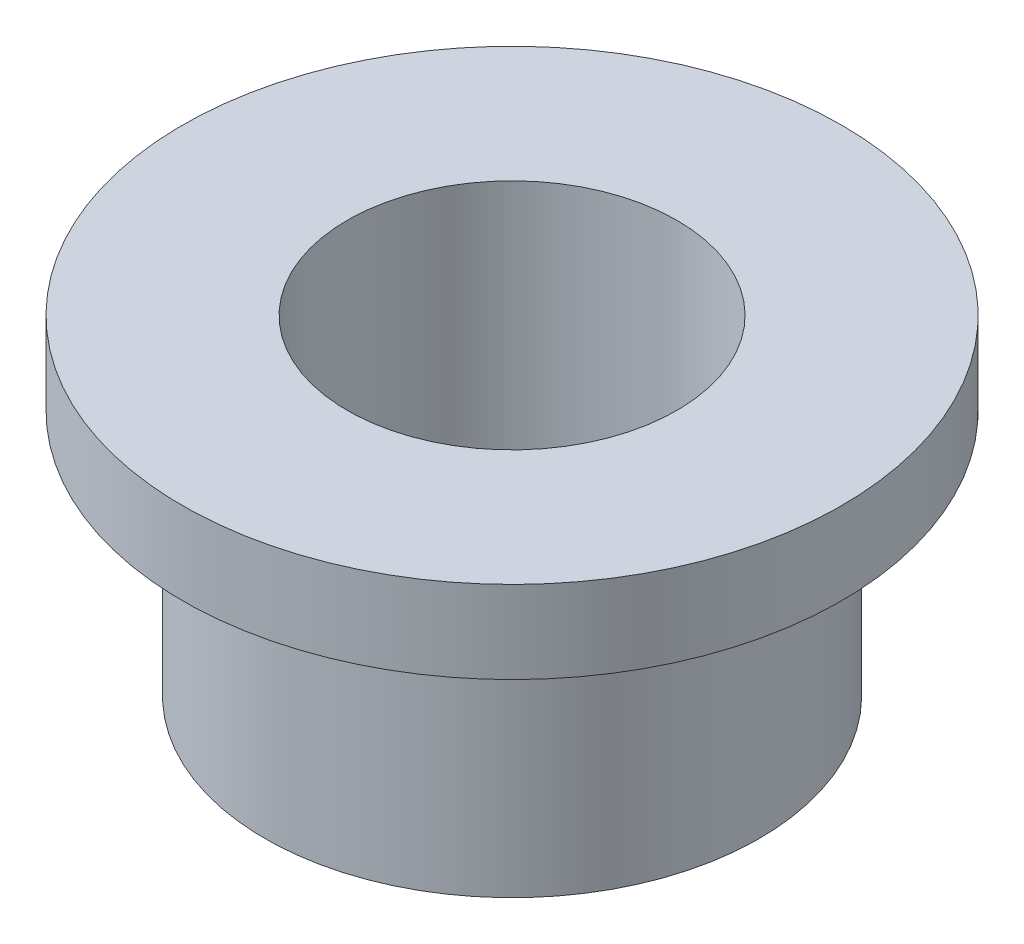
from build123d import *


with BuildPart() as part:
    # Sketch1 → Revolve1 (revolve)
    with BuildSketch(Plane.XY, mode=Mode.PRIVATE) as revolve1_sk:
        Polygon((6.35, 0), (6.35, 12.7), (12.7, 12.7), (12.7, 9.525), (9.525, 9.525), (9.525, 0), align=None)
    revolve(revolve1_sk.sketch.rotate(Axis((0, 0, 0), (0, 1, 0)), 90), axis=Axis((0, 0, 0), (0, 1, 0)))


solid = part.part
